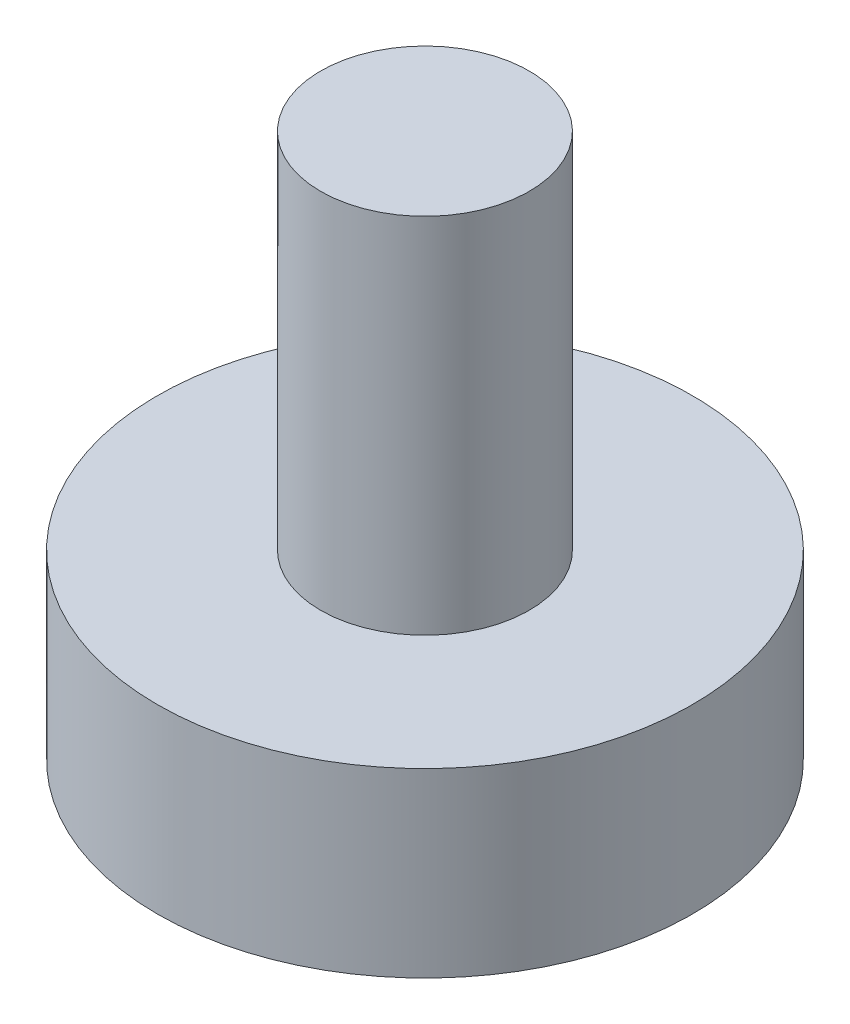
from build123d import *

# Parameters (mm, degrees)
SKETCH1_R           = 2.95
BOSS_EXTRUDE1_DEPTH = 2
SKETCH2_R           = 1.15
BOSS_EXTRUDE2_DEPTH = 4


with BuildPart() as part:
    # Sketch1 → Boss-Extrude1 (new body)
    with BuildSketch(Plane(origin=(0, 0, 0), x_dir=(1, 0, 0), z_dir=(0, 1, 0))):
        with Locations(Location((0, 0, 0), (0, 0, 270))):
            Circle(SKETCH1_R)
    extrude(amount=BOSS_EXTRUDE1_DEPTH)

    # Sketch2 → Boss-Extrude2 (add)
    with BuildSketch(Plane(origin=(0, 2, 0), x_dir=(1, 0, 0), z_dir=(0, 1, 0))):
        with Locations(Location((0, 0, 0), (0, 0, 270))):
            Circle(SKETCH2_R)
    extrude(amount=BOSS_EXTRUDE2_DEPTH)


solid = part.part
